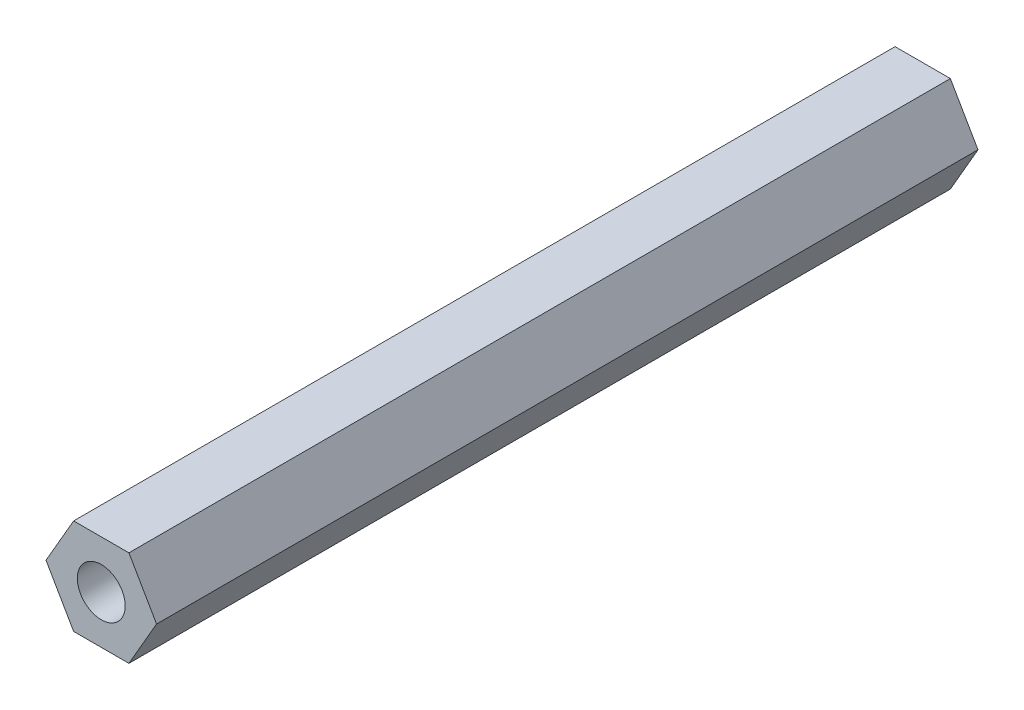
from build123d import *

# Parameters (mm, degrees)
SKETCH1_R           = 3.175
BOSS_EXTRUDE1_DEPTH = 54.483


with BuildPart() as part:
    # Sketch1 → Boss-Extrude1 (new, symmetric)
    with BuildSketch(Plane.XY):
        Polygon((3.666174209, 6.35), (-3.666174209, 6.35), (-7.332348419, 0), (-3.666174209, -6.35), (3.666174209, -6.35), (7.332348419, 0), align=None)
        Circle(SKETCH1_R, mode=Mode.SUBTRACT)
    extrude(amount=BOSS_EXTRUDE1_DEPTH, both=True)


solid = part.part
